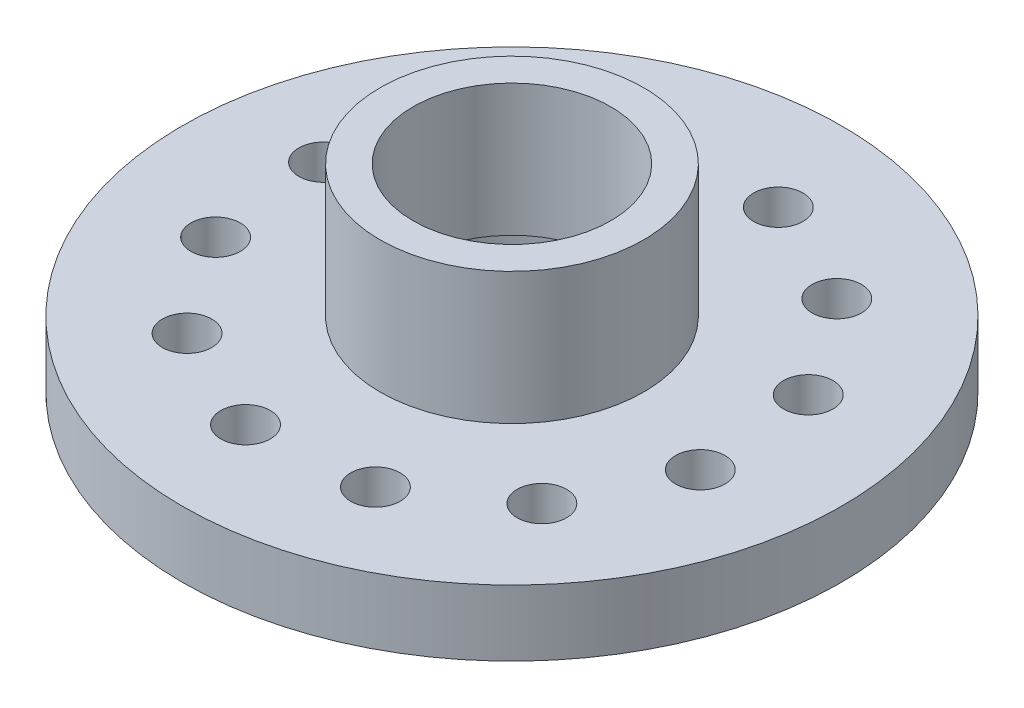
from build123d import *

# Parameters (mm, degrees)
SKETCH1_R           = 10
SKETCH1_R_2         = 4
BOSS_EXTRUDE1_DEPTH = 2
SKETCH2_R           = 4
SKETCH2_R_2         = 3
BOSS_EXTRUDE2_DEPTH = 4
SKETCH3_R           = 0.75
CUT_EXTRUDE1_DEPTH  = 15.696938457


with BuildPart() as part:
    # Sketch1 → Boss-Extrude1 (new body)
    with BuildSketch(Plane(origin=(0, 0, 0), x_dir=(1, 0, 0), z_dir=(0, 1, 0))):
        with Locations(Location((0, 0, 0), (0, 0, 270))):
            Circle(SKETCH1_R)
        with Locations(Location((0, 0, 0), (0, 0, 270))):
            Circle(SKETCH1_R_2, mode=Mode.SUBTRACT)
    extrude(amount=BOSS_EXTRUDE1_DEPTH)

    # Sketch3 → Cut-Extrude1 (cut, through all)
    with BuildSketch(Plane(origin=(0, 2, 0), x_dir=(1, 0, 0), z_dir=(0, 1, 0))):
        with Locations(Location((-5.383090008, 4.474633166, 0), (0, 0, 270))):
            Circle(SKETCH3_R)
        with Locations(Location((-2.424576114, 6.566690998, 0), (0, 0, 270))):
            Circle(SKETCH3_R)
        with Locations(Location((1.183600991, 6.89920928, 0), (0, 0, 270))):
            Circle(SKETCH3_R)
        with Locations(Location((4.474633166, 5.383090008, 0), (0, 0, 270))):
            Circle(SKETCH3_R)
        with Locations(Location((6.566690998, 2.424576114, 0), (0, 0, 270))):
            Circle(SKETCH3_R)
        with Locations(Location((6.89920928, -1.183600991, 0), (0, 0, 270))):
            Circle(SKETCH3_R)
        with Locations(Location((5.383090008, -4.474633166, 0), (0, 0, 270))):
            Circle(SKETCH3_R)
        with Locations(Location((2.424576114, -6.566690998, 0), (0, 0, 270))):
            Circle(SKETCH3_R)
        with Locations(Location((-1.183600991, -6.89920928, 0), (0, 0, 270))):
            Circle(SKETCH3_R)
        with Locations(Location((-4.474633166, -5.383090008, 0), (0, 0, 270))):
            Circle(SKETCH3_R)
        with Locations(Location((-6.566690998, -2.424576114, 0), (0, 0, 270))):
            Circle(SKETCH3_R)
        with Locations(Location((-6.89920928, 1.183600991, 0), (0, 0, 270))):
            Circle(SKETCH3_R)
    extrude(amount=-CUT_EXTRUDE1_DEPTH, mode=Mode.SUBTRACT)


with BuildPart() as body_2:
    # Sketch2 → Boss-Extrude2 (new body)
    with BuildSketch(Plane(origin=(0, 2, 0), x_dir=(1, 0, 0), z_dir=(0, 1, 0))):
        with Locations(Location((0, 0, 0), (0, 0, 270))):
            Circle(SKETCH2_R)
        with Locations(Location((0, 0, 0), (0, 0, 270))):
            Circle(SKETCH2_R_2, mode=Mode.SUBTRACT)
    extrude(amount=BOSS_EXTRUDE2_DEPTH)


solid = Compound([part.part, body_2.part])
